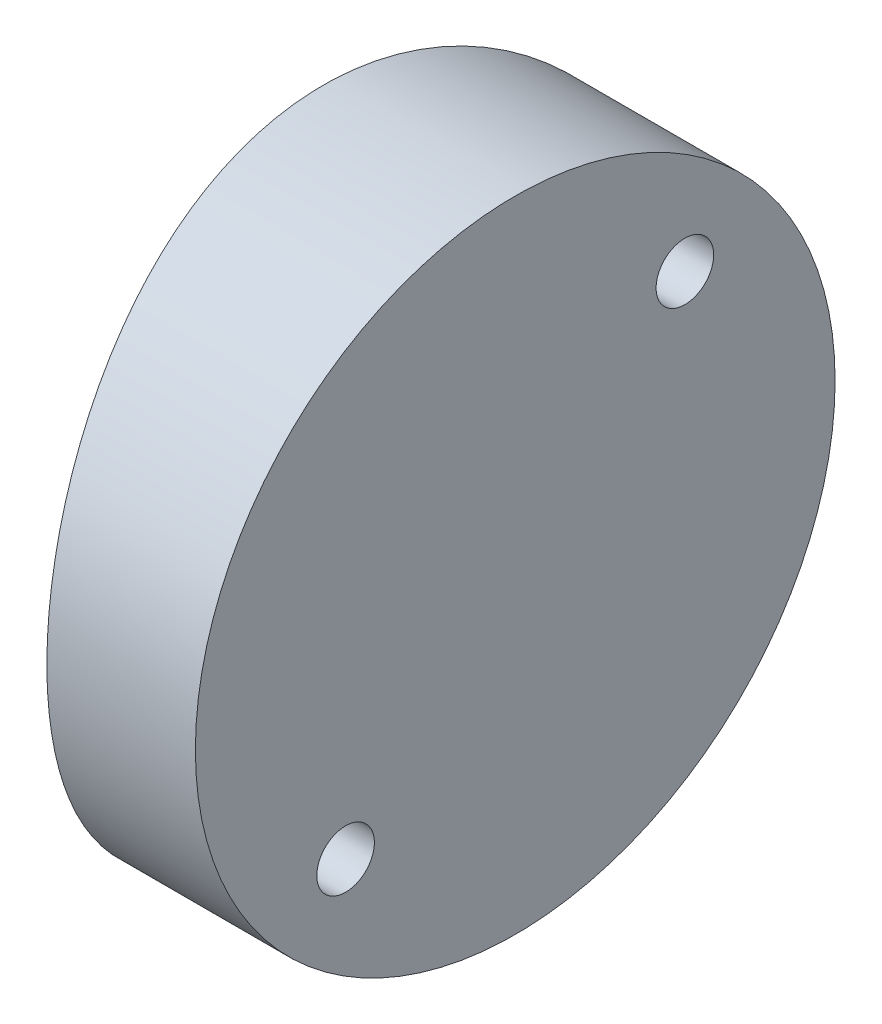
from build123d import *

# Parameters (mm, degrees)
SKETCH1_R                              = 20
BLOCO_DEPTH                            = 12
FURO_DE_FIXA_O_PARAFUSO_M3_D           = 3.6
FURO_DE_FIXA_O_PARAFUSO_M3_CBORE_D     = 6.5
FURO_DE_FIXA_O_PARAFUSO_M3_CBORE_DEPTH = 3
CORTE_ARREDONDAMENTO_DEPTH             = 31.724582991
CORTE_ARREDONDAMENTO_DEPTH_BACK        = 31.724582991
SKETCH7_R                              = 100
SKETCH7_R_2                            = 75


with BuildPart() as part:
    # Sketch1 → Bloco (new body)
    with BuildSketch(Plane(origin=(0, 0, 0), x_dir=(0, 0, -1), z_dir=(1, 0, 0))):
        Circle(SKETCH1_R)
    extrude(amount=BLOCO_DEPTH)

    # Furo de Fixação - Parafuso M3 (through all)
    with Locations(Plane.ZY):
        with Locations((10.606601718, -10.606601718), (-10.606601718, 10.606601718)):
            CounterBoreHole(FURO_DE_FIXA_O_PARAFUSO_M3_D / 2, FURO_DE_FIXA_O_PARAFUSO_M3_CBORE_D / 2, FURO_DE_FIXA_O_PARAFUSO_M3_CBORE_DEPTH)

    # Sketch7 → Corte - Arredondamento (cut, two sides: drawn at the far end of the back side and taken through both)
    with BuildSketch(Plane(origin=(0, 0, 0), x_dir=(1, 0, 0), z_dir=(0, 1, 0)).offset(-CORTE_ARREDONDAMENTO_DEPTH_BACK)):
        with Locations((75, 0)):
            Circle(SKETCH7_R)
        with Locations((75, 0)):
            Circle(SKETCH7_R_2, mode=Mode.SUBTRACT)
    extrude(amount=CORTE_ARREDONDAMENTO_DEPTH + CORTE_ARREDONDAMENTO_DEPTH_BACK, mode=Mode.SUBTRACT)


solid = part.part
